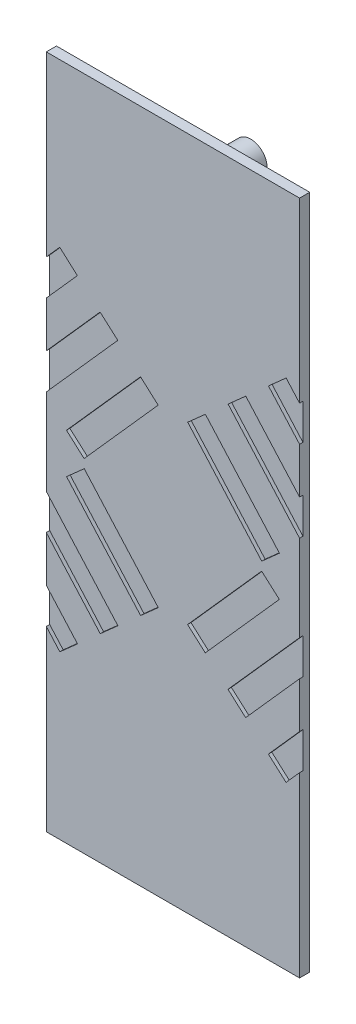
from build123d import *

# Parameters (mm, degrees)
SKETCH1_W           = 225
SKETCH1_H           = 200
BOSS_EXTRUDE1_DEPTH = 3
CUT_EXTRUDE1_DEPTH  = 1
SKETCH4_R           = 4.9
BOSS_EXTRUDE2_DEPTH = 10
SKETCH5_W           = 75
SKETCH5_H           = 200
CUT_EXTRUDE2_DEPTH  = 10


with BuildPart() as part:
    # Sketch1 → Boss-Extrude1 (new body)
    with BuildSketch(Plane.XY):
        with Locations((112.5, 100)):
            Rectangle(SKETCH1_W, SKETCH1_H)
    extrude(amount=BOSS_EXTRUDE1_DEPTH)

    # Sketch2 → Cut-Extrude1 (cut)
    with BuildSketch(Plane.XY.offset(3)):
        Polygon((21.176597363, 159.100101172), (43.100604044, 183.764608689), (48.332469275, 179.114061817), (26.408462593, 154.4495543), align=None)
        Polygon((9.218048264, 169.729922593), (31.142054945, 194.39443011), (36.373920176, 189.743883238), (14.449913495, 165.079375722), align=None)
        Polygon((33.135146462, 148.470279751), (55.059153143, 173.134787267), (60.291018374, 168.484240396), (38.367011692, 143.819732879), align=None)
        Polygon((45.093695561, 137.840458329), (67.017702242, 162.504965846), (72.249567473, 157.854418974), (50.325560791, 133.189911458), align=None)
        Polygon((57.05224466, 127.210636908), (78.976251341, 151.875144425), (84.208116572, 147.224597553), (62.28410989, 122.560090036), align=None)
        Polygon((69.010793758, 116.580815487), (90.93480044, 141.245323003), (96.166665671, 136.594776132), (74.242658989, 111.930268615), align=None)
        Polygon((80.969342857, 105.950994066), (102.893349539, 130.615501582), (108.12521477, 125.96495471), (86.201208088, 101.300447194), align=None)
        Polygon((116.844990154, 74.061529802), (138.768996836, 98.726037318), (144.000862066, 94.075490447), (122.076855385, 69.41098293), align=None)
        Polygon((128.803539253, 63.431708381), (150.727545935, 88.096215897), (155.959411165, 83.445669025), (134.035404484, 58.781161509), align=None)
        Polygon((140.762088352, 52.801886959), (162.686095033, 77.466394476), (167.917960264, 72.815847604), (145.993953583, 48.151340087), align=None)
        Polygon((152.720637451, 42.172065538), (174.644644132, 66.836573055), (179.876509363, 62.186026183), (157.952502682, 37.521518666), align=None)
        Polygon((164.67918655, 31.542244117), (186.603193231, 56.206751633), (191.835058462, 51.556204761), (169.911051781, 26.891697245), align=None)
        Polygon((176.637735649, 20.912422695), (198.56174233, 45.576930212), (203.793607561, 40.92638334), (181.86960088, 16.261875824), align=None)
        Polygon((188.596284748, 10.282601274), (210.520291429, 34.947108791), (215.75215666, 30.296561919), (193.828149979, 5.632054402), align=None)
        Polygon((198.591537407, 154.4495543), (176.667530725, 179.114061817), (181.899395956, 183.764608689), (203.823402637, 159.100101172), align=None)
        Polygon((210.550086505, 165.079375721), (188.626079824, 189.743883238), (193.857945055, 194.39443011), (215.781951736, 169.729922593), align=None)
        Polygon((186.632988308, 143.819732879), (164.708981626, 168.484240395), (169.940846857, 173.134787267), (191.864853538, 148.470279751), align=None)
        Polygon((174.674439209, 133.189911458), (152.750432527, 157.854418974), (157.982297758, 162.504965846), (179.906304439, 137.840458329), align=None)
        Polygon((162.71589011, 122.560090036), (140.791883428, 147.224597553), (146.023748659, 151.875144425), (167.94775534, 127.210636908), align=None)
        Polygon((150.757341011, 111.930268615), (128.833334329, 136.594776132), (134.06519956, 141.245323003), (155.989206242, 116.580815487), align=None)
        Polygon((138.798791912, 101.300447194), (116.87478523, 125.96495471), (122.106650461, 130.615501582), (144.030657143, 105.950994066), align=None)
        Polygon((102.923144615, 69.41098293), (80.999137934, 94.075490447), (86.231003164, 98.726037318), (108.155009846, 74.061529802), align=None)
        Polygon((90.964595516, 58.781161509), (69.040588835, 83.445669025), (74.272454065, 88.096215897), (96.196460747, 63.431708381), align=None)
        Polygon((79.006046417, 48.151340087), (57.082039736, 72.815847604), (62.313904967, 77.466394476), (84.237911648, 52.801886959), align=None)
        Polygon((67.047497318, 37.521518666), (45.123490637, 62.186026183), (50.355355868, 66.836573055), (72.279362549, 42.172065538), align=None)
        Polygon((55.088948219, 26.891697245), (33.164941538, 51.556204761), (38.396806769, 56.206751633), (60.32081345, 31.542244117), align=None)
        Polygon((43.13039912, 16.261875824), (21.206392439, 40.92638334), (26.43825767, 45.576930212), (48.362264351, 20.912422695), align=None)
        Polygon((31.171850021, 5.632054402), (9.24784334, 30.296561919), (14.479708571, 34.947108791), (36.403715252, 10.282601274), align=None)
    extrude(amount=-CUT_EXTRUDE1_DEPTH, mode=Mode.SUBTRACT)

    # Sketch4 → Boss-Extrude2 (add)
    with BuildSketch(Plane(origin=(0, 0, 0), x_dir=(-1, 0, 0), z_dir=(0, 0, -1))):
        with Locations((-102.5, 10)):
            Circle(SKETCH4_R)
        with Locations((-122.5, 190)):
            Circle(SKETCH4_R)
    extrude(amount=BOSS_EXTRUDE2_DEPTH)

    # Sketch5 → Cut-Extrude2 (cut)
    with BuildSketch(Plane(origin=(0, 0, 0), x_dir=(-1, 0, 0), z_dir=(0, 0, -1))):
        with Locations((-37.5, 100)):
            Rectangle(SKETCH5_W, SKETCH5_H)
        with Locations((-187.5, 100)):
            Rectangle(SKETCH5_W, SKETCH5_H)
    extrude(amount=-CUT_EXTRUDE2_DEPTH, mode=Mode.SUBTRACT)


solid = part.part
